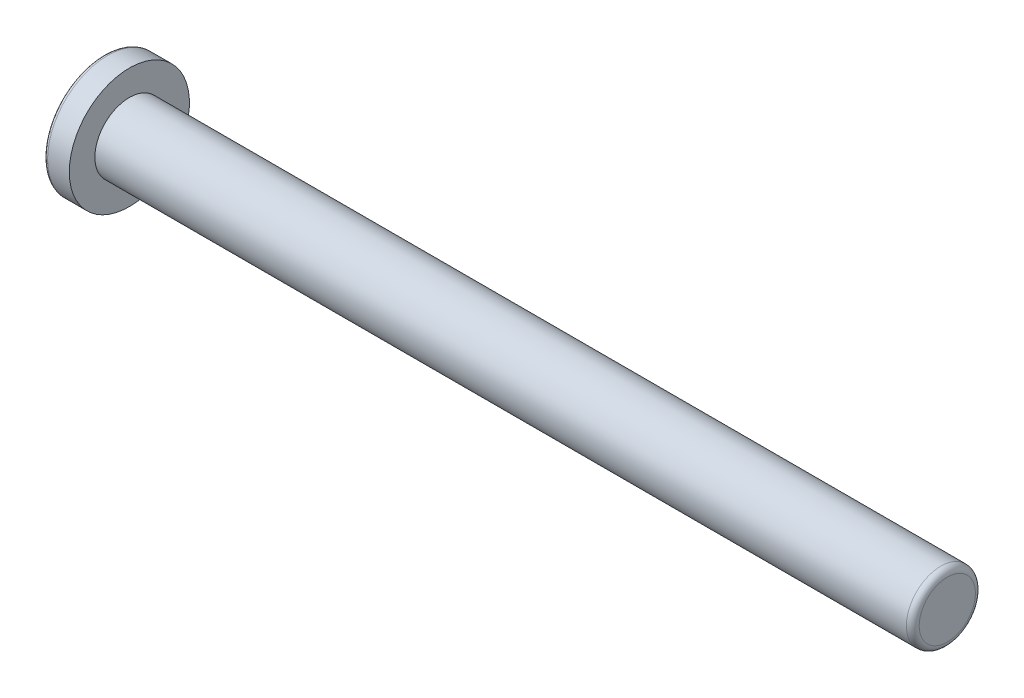
from build123d import *

# Parameters (mm, degrees)
FILLET1_R = 3
FILLET2_R = 5


with BuildPart() as part:
    # Sketch1 → Revolve1 (revolve)
    with BuildSketch(Plane.XY, mode=Mode.PRIVATE) as revolve1_sk:
        Polygon((0, 0), (0, 27), (-640, 27), (-640, 47), (-660, 47), (-660, 0), align=None)
    revolve(revolve1_sk.sketch.rotate(Axis((-660, 0, 0), (1, 0, 0)), 90), axis=Axis((-660, 0, 0), (1, 0, 0)))

    # Fillet1
    fillet1_edges = [part.edges().sort_by_distance(p)[0] for p in [
        (-660, 0, -47),
    ]]
    fillet(fillet1_edges, radius=FILLET1_R)

    # Fillet2
    fillet2_edges = [part.edges().sort_by_distance(p)[0] for p in [
        (0, 0, -27),
    ]]
    fillet(fillet2_edges, radius=FILLET2_R)


solid = part.part
